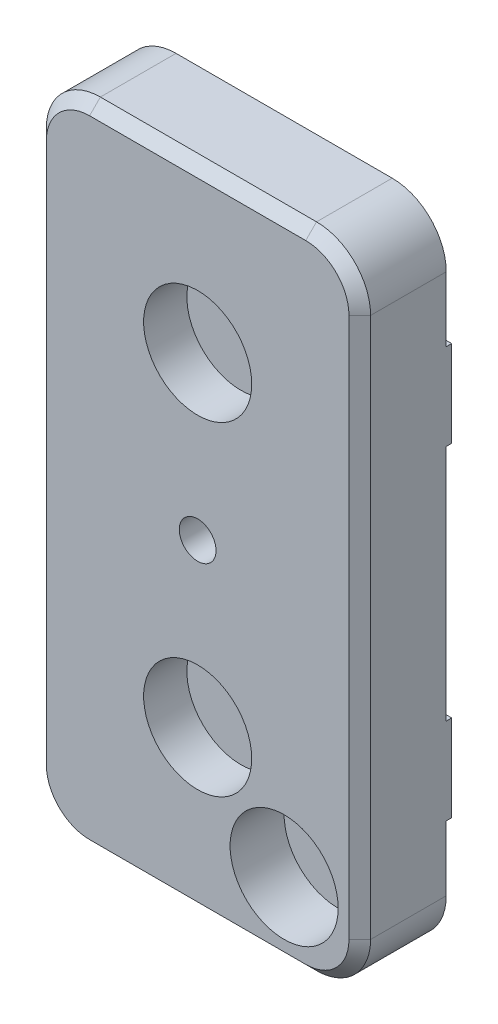
from build123d import *

# Parameters (mm, degrees)
BOSS_EXTRUDE1_DEPTH                                 = 15
M4_CLEARANCE_HOLE1_D                                = 4.5
M4_CLEARANCE_HOLE1_DEPTH                            = 16
M4_CLEARANCE_HOLE1_TIP                              = 1.351936393
CBORE_FOR_M3_HEX_SOCKET_HEAD_CAP_SCREW1_D           = 3.4
CBORE_FOR_M3_HEX_SOCKET_HEAD_CAP_SCREW1_CBORE_D     = 6.5
CBORE_FOR_M3_HEX_SOCKET_HEAD_CAP_SCREW1_CBORE_DEPTH = 6
FILLET1_R                                           = 5
CHAMFER1_SIZE                                       = 1
SKETCH6_R                                           = 5
CUT_EXTRUDE1_DEPTH                                  = 5
SKETCH7_R                                           = 5
CUT_EXTRUDE2_DEPTH                                  = 4
BOSS_EXTRUDE2_START                                 = -0.4
SKETCH8_R                                           = 2.25
BOSS_EXTRUDE2_DEPTH                                 = 0.4


with BuildPart() as part:
    # Sketch1 → Boss-Extrude1 (new, symmetric)
    with BuildSketch(Plane(origin=(0, 0, 0), x_dir=(0, 0, -1), z_dir=(1, 0, 0))):
        Polygon((8, -19), (8, -30), (0, -30), (0, 30), (8, 30), (8, 19), (8.5, 19), (8.5, 11), (8, 11), (8, -11), (8.5, -11), (8.5, -19), align=None)
    extrude(amount=BOSS_EXTRUDE1_DEPTH, both=True)

    # M4 Clearance Hole1
    with Locations(Plane.XY):
        with Locations((0, -15), (0, 15)):
            Hole(M4_CLEARANCE_HOLE1_D / 2, depth=M4_CLEARANCE_HOLE1_DEPTH)
            with Locations((0, 0, -(M4_CLEARANCE_HOLE1_DEPTH + M4_CLEARANCE_HOLE1_TIP / 2))):  # 118° drill point
                Cone(0, M4_CLEARANCE_HOLE1_D / 2, M4_CLEARANCE_HOLE1_TIP, mode=Mode.SUBTRACT)

    # CBORE for M3 Hex Socket Head Cap Screw1 (through all)
    with Locations(Plane(origin=(0, 0, -8.5), x_dir=(-1, 0, 0), z_dir=(0, 0, -1))):
        with Locations((0, 0)):
            CounterBoreHole(CBORE_FOR_M3_HEX_SOCKET_HEAD_CAP_SCREW1_D / 2, CBORE_FOR_M3_HEX_SOCKET_HEAD_CAP_SCREW1_CBORE_D / 2, CBORE_FOR_M3_HEX_SOCKET_HEAD_CAP_SCREW1_CBORE_DEPTH)

    # Fillet1
    fillet1_edges = [part.edges().sort_by_distance(p)[0] for p in [
        (-15, -30, -4),
        (-15, 30, -4),
        (15, 30, -4),
        (15, -30, -4),
    ]]
    fillet(fillet1_edges, radius=FILLET1_R)

    # Chamfer1
    chamfer1_edges = [part.edges().sort_by_distance(p)[0] for p in [
        (0, 30, 0),
        (-15, 0, 0),
        (0, -30, 0),
        (15, 0, 0),
        (-13.535533906, -28.535533906, 0),
        (13.535533906, -28.535533906, 0),
        (13.535533906, 28.535533906, 0),
        (-13.535533906, 28.535533906, 0),
    ]]
    chamfer(chamfer1_edges, length=CHAMFER1_SIZE)

    # Sketch6 → Cut-Extrude1 (cut)
    with BuildSketch(Plane.XY):
        with Locations((8, -23)):
            Circle(SKETCH6_R)
    extrude(amount=-CUT_EXTRUDE1_DEPTH, mode=Mode.SUBTRACT)

    # Sketch7 → Cut-Extrude2 (cut)
    with BuildSketch(Plane.XY):
        with Locations((0, 15)):
            Circle(SKETCH7_R)
        with Locations((0, -15)):
            Circle(SKETCH7_R)
    extrude(amount=-CUT_EXTRUDE2_DEPTH, mode=Mode.SUBTRACT)

    # Sketch8 → Boss-Extrude2 (add)
    with BuildSketch(Plane.XY.offset(-4).offset(BOSS_EXTRUDE2_START)):
        with Locations((0, 15)):
            Circle(SKETCH8_R)
        with Locations((0, -15)):
            Circle(SKETCH8_R)
    extrude(amount=BOSS_EXTRUDE2_DEPTH)


solid = part.part
